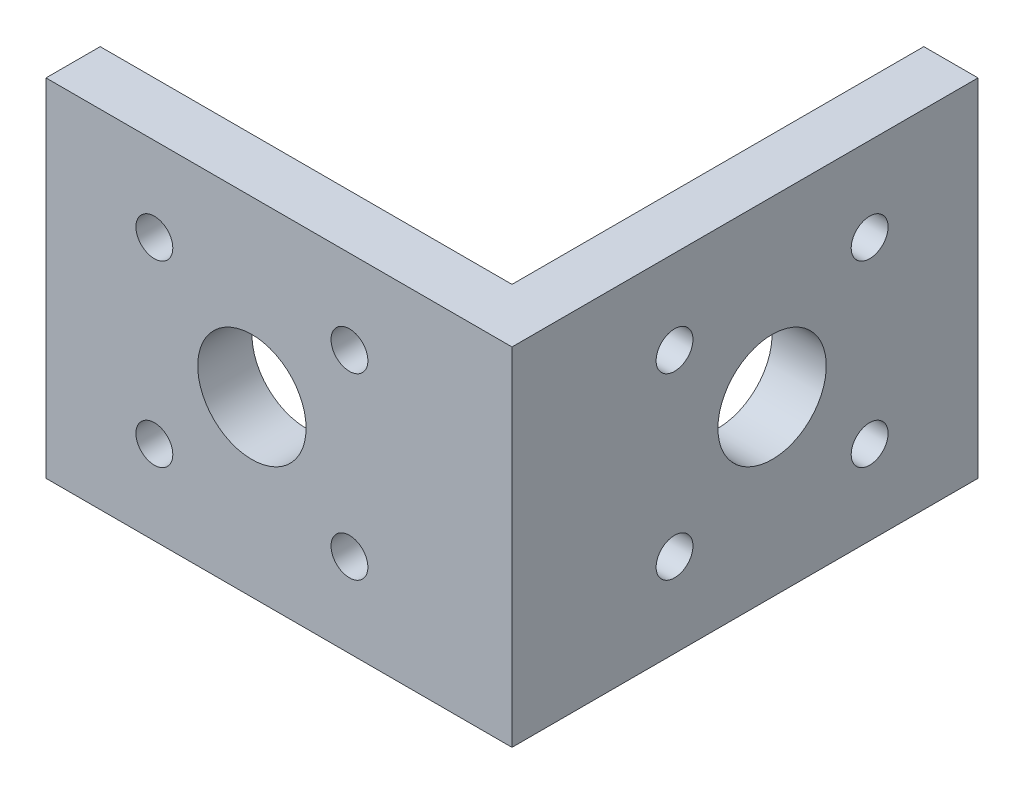
from build123d import *

# Parameters (mm, degrees)
SKETCH1_W           = 38
SKETCH1_H           = 32
SKETCH1_R           = 5
SKETCH1_R_2         = 1.7
BOSS_EXTRUDE1_DEPTH = 5
SKETCH2_W           = 5
SKETCH2_H           = 32
BOSS_EXTRUDE4_DEPTH = 5


with BuildPart() as part:
    # Sketch1 → Boss-Extrude1 (new body)
    with BuildSketch(Plane.XY):
        Rectangle(SKETCH1_W, SKETCH1_H)
        Circle(SKETCH1_R, mode=Mode.SUBTRACT)
        with Locations((-9, 8.25)):
            Circle(SKETCH1_R_2, mode=Mode.SUBTRACT)
        with Locations((9, 8.25)):
            Circle(SKETCH1_R_2, mode=Mode.SUBTRACT)
        with Locations((9, -8.25)):
            Circle(SKETCH1_R_2, mode=Mode.SUBTRACT)
        with Locations((-9, -8.25)):
            Circle(SKETCH1_R_2, mode=Mode.SUBTRACT)
    boss_extrude1 = extrude(amount=BOSS_EXTRUDE1_DEPTH)

    # Sketch2 → Boss-Extrude4 (add)
    with BuildSketch(Plane.XY):
        with Locations((21.5, 0)):
            Rectangle(SKETCH2_W, SKETCH2_H)
    extrude(amount=BOSS_EXTRUDE4_DEPTH)

    # Mirror3: Boss-Extrude1 across plane
    add(boss_extrude1.mirror(Plane(origin=(9.5, 0, -9.5), x_dir=(0.7071067811865478, 0, 0.7071067811865472), z_dir=(0.7071067811865475, 0, -0.7071067811865477))))


solid = part.part
